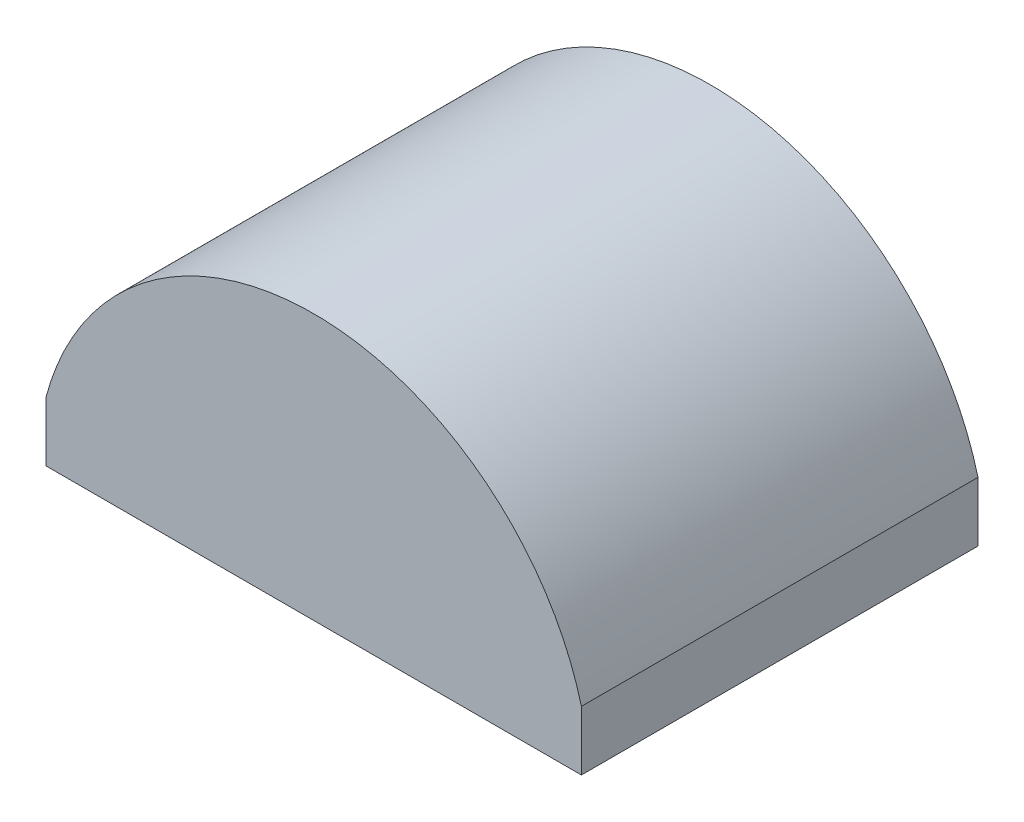
from build123d import *

# Parameters (mm, degrees)
BOSS_EXTRUDE1_DEPTH = 10
SKETCH2_R           = 3.6
CUT_EXTRUDE1_DEPTH  = 4
CHAMFER1_SIZE       = 0.5


with BuildPart() as part:
    # Sketch1 → Boss-Extrude1 (new body)
    with BuildSketch(Plane.XY):
        with BuildLine():
            Line((0, 0), (13.5, 0))
            Line((13.5, 0), (13.5, 2))
            ThreePointArc((13.5, 2), (6.75, 7.2), (0, 2))
            Line((0, 2), (0, 0))
        make_face()
    extrude(amount=BOSS_EXTRUDE1_DEPTH)

    # Sketch2 → Cut-Extrude1 (cut)
    with BuildSketch(Plane.XZ):
        with Locations(Location((6.75, 5, 0), (0, 0, 270))):
            Circle(SKETCH2_R)
    extrude(amount=-CUT_EXTRUDE1_DEPTH, mode=Mode.SUBTRACT)

    # Chamfer1
    chamfer1_edges = [part.edges().sort_by_distance(p)[0] for p in [
        (6.75, 0, 8.6),
        (6.75, 0, 0),
        (6.75, 0, 10),
        (13.5, 0, 5),
        (0, 0, 5),
    ]]
    chamfer(chamfer1_edges, length=CHAMFER1_SIZE)


solid = part.part
